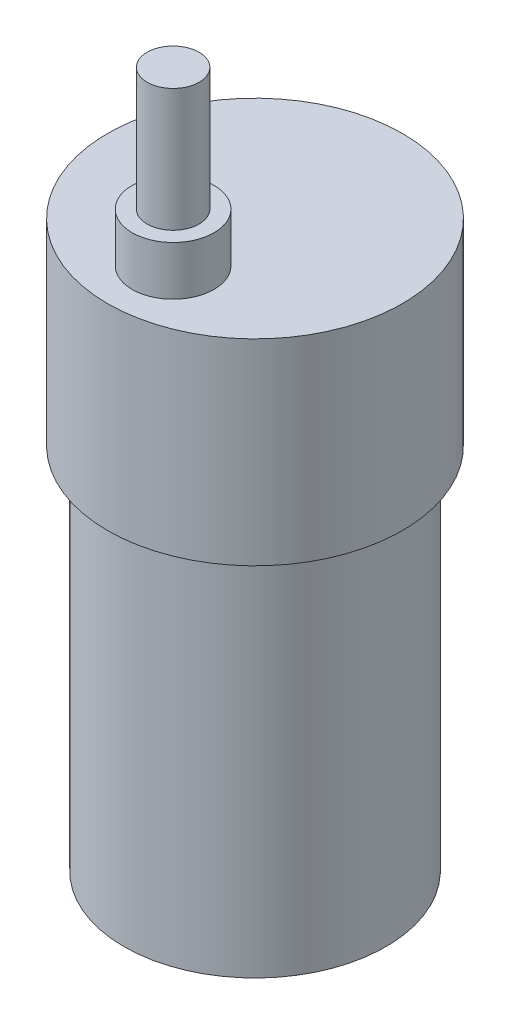
from build123d import *

# Parameters (mm, degrees)
SKETCH2_R                = 16
BOSS_EXTRUDE1_DEPTH      = 45
SKETCH3_R                = 18
BOSS_EXTRUDE2_DEPTH      = 24
SKETCH4_R                = 5
SKETCH4_R_2              = 3.175
BOSS_EXTRUDE3_DEPTH      = 6
BOSS_EXTRUDE4_DEPTH      = 15
BOSS_EXTRUDE4_DEPTH_BACK = 13.62
SKETCH5_R                = 3.175


with BuildPart() as part:
    # Sketch2 → Boss-Extrude1 (new body)
    with BuildSketch(Plane(origin=(0, 0, 0), x_dir=(1, 0, 0), z_dir=(0, 1, 0))):
        with Locations(Location((0, 0, 0), (0, 0, 90))):
            Circle(SKETCH2_R)
    extrude(amount=BOSS_EXTRUDE1_DEPTH)

    # Sketch3 → Boss-Extrude2 (add)
    with BuildSketch(Plane(origin=(0, 45, 0), x_dir=(1, 0, 0), z_dir=(0, 1, 0))):
        with Locations(Location((0, 0, 0), (0, 0, 270))):
            Circle(SKETCH3_R)
    extrude(amount=BOSS_EXTRUDE2_DEPTH)

    # Sketch4 → Boss-Extrude3 (add)
    with BuildSketch(Plane(origin=(0, 69, 0), x_dir=(1, 0, 0), z_dir=(0, 1, 0))):
        with Locations(Location((0, -10, 0), (0, 0, 270))):
            Circle(SKETCH4_R)
        with Locations(Location((0, -10, 0), (0, 0, 270))):
            Circle(SKETCH4_R_2, mode=Mode.SUBTRACT)
    extrude(amount=BOSS_EXTRUDE3_DEPTH)

    # Sketch5 → Boss-Extrude4 (add, two sides: drawn at the far end of the back side and taken through both)
    with BuildSketch(Plane(origin=(0, 75, 0), x_dir=(1, 0, 0), z_dir=(0, 1, 0)).offset(-BOSS_EXTRUDE4_DEPTH_BACK)):
        with Locations(Location((0, -10, 0), (0, 0, 270))):
            Circle(SKETCH5_R)
    extrude(amount=BOSS_EXTRUDE4_DEPTH + BOSS_EXTRUDE4_DEPTH_BACK)


solid = part.part
